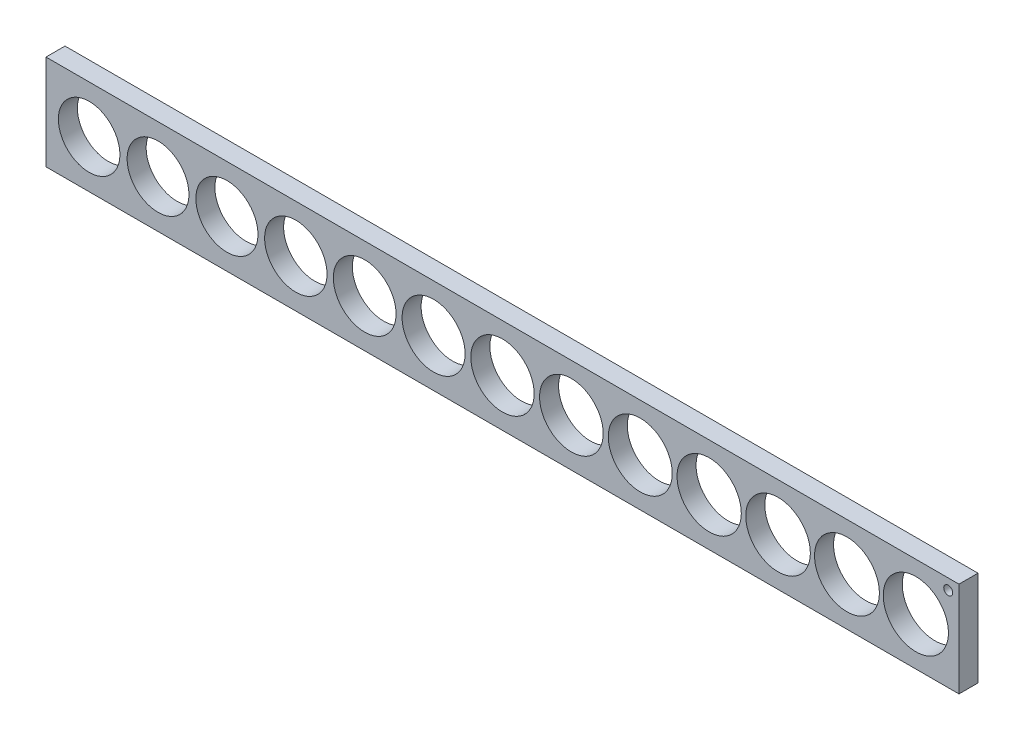
from build123d import *

# Parameters (mm, degrees)
SKETCH1_W           = 304.8
SKETCH1_H           = 31.75
SKETCH1_R           = 10.575
SKETCH1_R_2         = 10.6258
SKETCH1_R_3         = 10.6766
SKETCH1_R_4         = 10.7274
SKETCH1_R_5         = 10.7782
SKETCH1_R_6         = 10.829
SKETCH1_R_7         = 10.8798
SKETCH1_R_8         = 10.2702
SKETCH1_R_9         = 10.321
SKETCH1_R_10        = 10.3718
SKETCH1_R_11        = 10.4226
SKETCH1_R_12        = 10.4734
SKETCH1_R_13        = 10.5242
SKETCH1_R_14        = 1.5
BOSS_EXTRUDE1_DEPTH = 6.35


with BuildPart() as part:
    # Sketch1 → Boss-Extrude1 (new body)
    with BuildSketch(Plane.XY):
        Rectangle(SKETCH1_W, SKETCH1_H)
        Circle(SKETCH1_R, mode=Mode.SUBTRACT)
        with Locations((23, 0)):
            Circle(SKETCH1_R_2, mode=Mode.SUBTRACT)
        with Locations((46, 0)):
            Circle(SKETCH1_R_3, mode=Mode.SUBTRACT)
        with Locations((69, 0)):
            Circle(SKETCH1_R_4, mode=Mode.SUBTRACT)
        with Locations((92, 0)):
            Circle(SKETCH1_R_5, mode=Mode.SUBTRACT)
        with Locations((115, 0)):
            Circle(SKETCH1_R_6, mode=Mode.SUBTRACT)
        with Locations((138, 0)):
            Circle(SKETCH1_R_7, mode=Mode.SUBTRACT)
        with Locations(Location((-138, 0, 0), (0, 0, 180))):
            Circle(SKETCH1_R_8, mode=Mode.SUBTRACT)
        with Locations(Location((-115, 0, 0), (0, 0, 180))):
            Circle(SKETCH1_R_9, mode=Mode.SUBTRACT)
        with Locations(Location((-92, 0, 0), (0, 0, 180))):
            Circle(SKETCH1_R_10, mode=Mode.SUBTRACT)
        with Locations(Location((-69, 0, 0), (0, 0, 180))):
            Circle(SKETCH1_R_11, mode=Mode.SUBTRACT)
        with Locations(Location((-46, 0, 0), (0, 0, 180))):
            Circle(SKETCH1_R_12, mode=Mode.SUBTRACT)
        with Locations(Location((-23, 0, 0), (0, 0, 180))):
            Circle(SKETCH1_R_13, mode=Mode.SUBTRACT)
        with Locations((148.807897552, 12.282897552)):
            Circle(SKETCH1_R_14, mode=Mode.SUBTRACT)
    extrude(amount=BOSS_EXTRUDE1_DEPTH)


solid = part.part
